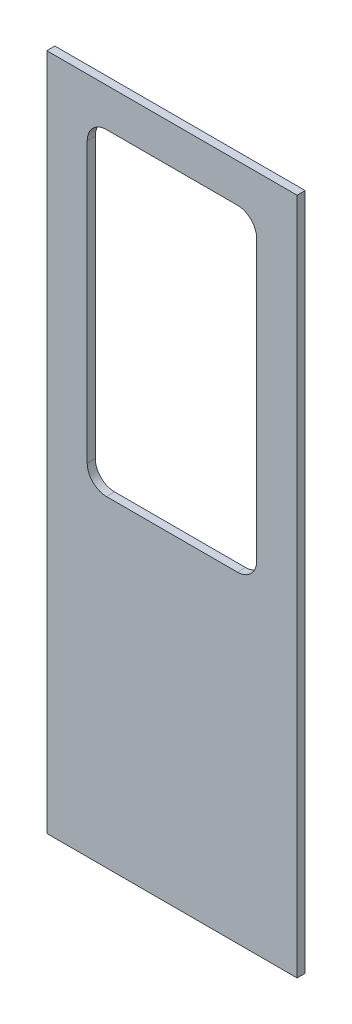
from build123d import *

# Parameters (mm, degrees)
SKETCH1_W           = 82.55
SKETCH1_H           = 223.52
BOSS_EXTRUDE1_DEPTH = 2.667


with BuildPart() as part:
    # Sketch1 → Boss-Extrude1 (new body)
    with BuildSketch(Plane.XY):
        Rectangle(SKETCH1_W, SKETCH1_H)
        with BuildLine():
            Line((-21.59, 99.06), (21.59, 99.06))
            ThreePointArc((21.59, 99.06), (26.080128061, 97.200128061), (27.94, 92.71))
            Line((27.94, 92.71), (27.94, 0.635))
            ThreePointArc((27.94, 0.635), (26.080128061, -3.855128061), (21.59, -5.715))
            Line((21.59, -5.715), (-21.59, -5.715))
            ThreePointArc((-21.59, -5.715), (-26.080128061, -3.855128061), (-27.94, 0.635))
            Line((-27.94, 0.635), (-27.94, 92.71))
            ThreePointArc((-27.94, 92.71), (-26.080128061, 97.200128061), (-21.59, 99.06))
        make_face(mode=Mode.SUBTRACT)
    extrude(amount=BOSS_EXTRUDE1_DEPTH)


solid = part.part
